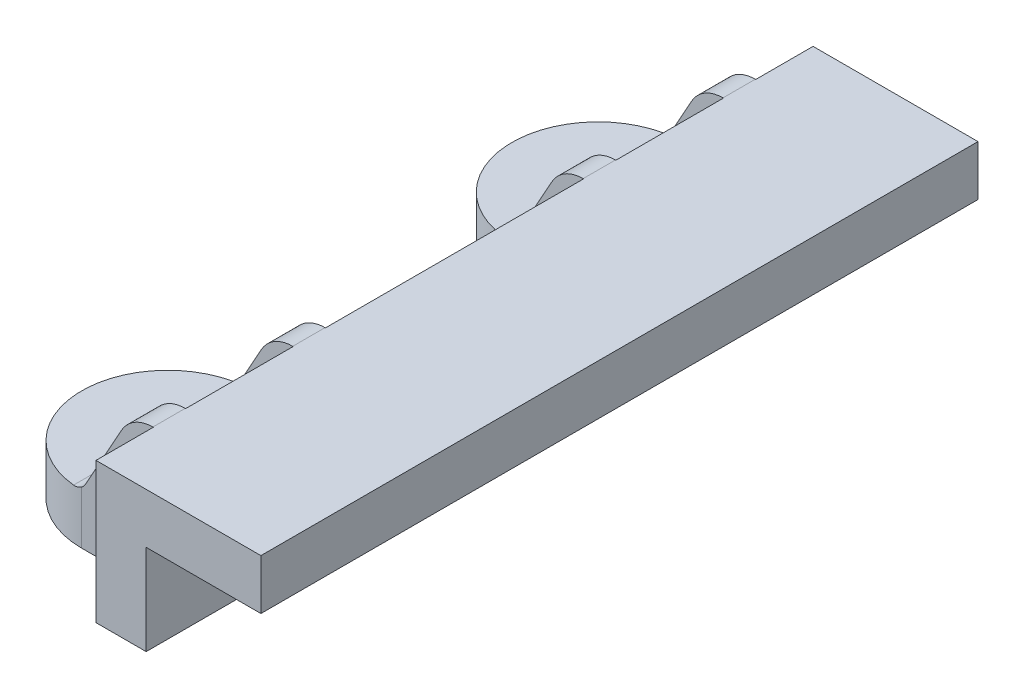
from build123d import *

# Parameters (mm, degrees)
SALIENTE_EXTRUIR1_DEPTH  = 25
CROQUIS2_R               = 2.25
SALIENTE_EXTRUIR2_DEPTH  = 3.5
SALIENTE_EXTRUIR3_DEPTH  = 2.25
REDONDEO3_R              = 1
REDONDEO5_R              = 2.5
REDONDEO3_OF_SIMETR_A1_R = 1
REDONDEO5_OF_SIMETR_A1_R = 2.5
REDONDEO3_OF_SIMETR_A4_R = 1
REDONDEO5_OF_SIMETR_A4_R = 2.5
SALIENTE_EXTRUIR4_DEPTH  = 2.25
REDONDEO6_R              = 2.5
REDONDEO7_R              = 1


with BuildPart() as part:
    # Croquis1 → Saliente-Extruir1 (new, symmetric)
    with BuildSketch(Plane.XY):
        Polygon((0, 0), (0, 9.8), (11.5, 9.8), (11.5, 6.3), (3.5, 6.3), (3.5, 0), align=None)
    extrude(amount=SALIENTE_EXTRUIR1_DEPTH, both=True)

    # Croquis2 → Saliente-Extruir2 (add)
    with BuildSketch(Plane(origin=(0, 0, 0), x_dir=(1, 0, 0), z_dir=(0, 1, 0))):
        with BuildLine():
            Line((0, 9), (-5, 9))
            ThreePointArc((-5, 9), (-11, 15), (-5, 21))
            Line((-5, 21), (0, 21))
            Line((0, 21), (0, 9))
        make_face()
        with Locations(Location((-5, 15, 0), (0, 0, 270))):
            Circle(CROQUIS2_R, mode=Mode.SUBTRACT)
    saliente_extruir2 = extrude(amount=SALIENTE_EXTRUIR2_DEPTH)

    # Croquis3 → Saliente-Extruir3 (add)
    with BuildSketch(Plane.XY.offset(-9)):
        Polygon((0, 9.8), (0, 3.5), (-5, 3.5), (-1.5, 9.8), align=None)
    saliente_extruir3 = extrude(amount=-SALIENTE_EXTRUIR3_DEPTH)

    # Redondeo3
    redondeo3_edges = [part.edges().sort_by_distance(p)[0] for p in [
        (-5, 3.5, -10.125),
    ]]
    fillet(redondeo3_edges, radius=REDONDEO3_R)

    # Redondeo5
    redondeo5_edges = [part.edges().sort_by_distance(p)[0] for p in [
        (-1.5, 9.8, -10.125),
    ]]
    fillet(redondeo5_edges, radius=REDONDEO5_R)

    # Simetría1: Saliente-Extruir3 across plane
    add(saliente_extruir3.mirror(Plane(origin=(0, 0, -15), x_dir=(1, 0, 0), z_dir=(0, 0, -1))))

    # Redondeo3 of Simetría1
    redondeo3_of_simetr_a1_edges = [part.edges().sort_by_distance(p)[0] for p in [
        (-5, 3.5, -19.875),
    ]]
    fillet(redondeo3_of_simetr_a1_edges, radius=REDONDEO3_OF_SIMETR_A1_R)

    # Redondeo5 of Simetría1
    redondeo5_of_simetr_a1_edges = [part.edges().sort_by_distance(p)[0] for p in [
        (-1.5, 9.8, -19.875),
    ]]
    fillet(redondeo5_of_simetr_a1_edges, radius=REDONDEO5_OF_SIMETR_A1_R)

    # Simetría4: Saliente-Extruir2, Saliente-Extruir3 across plane
    add(saliente_extruir2.mirror(Plane.XY))
    add(saliente_extruir3.mirror(Plane.XY))

    # Redondeo3 of Simetría4
    redondeo3_of_simetr_a4_edges = [part.edges().sort_by_distance(p)[0] for p in [
        (-5, 3.5, 10.125),
    ]]
    fillet(redondeo3_of_simetr_a4_edges, radius=REDONDEO3_OF_SIMETR_A4_R)

    # Redondeo5 of Simetría4
    redondeo5_of_simetr_a4_edges = [part.edges().sort_by_distance(p)[0] for p in [
        (-1.5, 9.8, 10.125),
    ]]
    fillet(redondeo5_of_simetr_a4_edges, radius=REDONDEO5_OF_SIMETR_A4_R)

    # Croquis4 → Saliente-Extruir4 (add)
    with BuildSketch(Plane.XY.offset(21)):
        Polygon((0, 3.5), (-5, 3.5), (-1.5, 9.8), (0, 9.8), align=None)
    extrude(amount=-SALIENTE_EXTRUIR4_DEPTH)

    # Redondeo6
    redondeo6_edges = [part.edges().sort_by_distance(p)[0] for p in [
        (-1.5, 9.8, 19.875),
    ]]
    fillet(redondeo6_edges, radius=REDONDEO6_R)

    # Redondeo7
    redondeo7_edges = [part.edges().sort_by_distance(p)[0] for p in [
        (-5, 3.5, 19.875),
    ]]
    fillet(redondeo7_edges, radius=REDONDEO7_R)


solid = part.part
